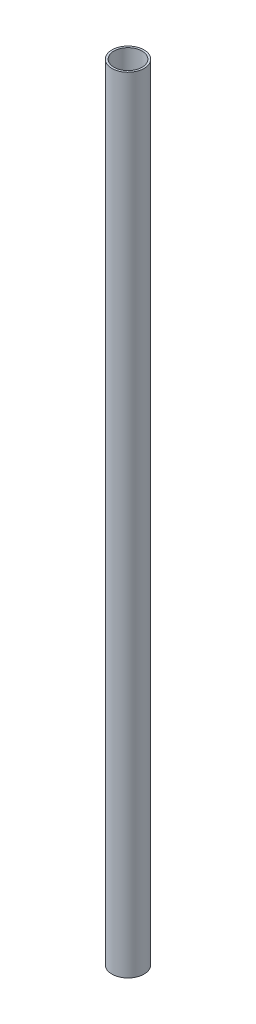
from build123d import *

# Parameters (mm, degrees)
SKETCH1_R           = 4
SKETCH1_R_2         = 3.5
BOSS_EXTRUDE1_DEPTH = 195


with BuildPart() as part:
    # Sketch1 → Boss-Extrude1 (new body)
    with BuildSketch(Plane(origin=(0, 0, 0), x_dir=(1, 0, 0), z_dir=(0, 1, 0))):
        with Locations(Location((0, 0, 0), (0, 0, 270))):
            Circle(SKETCH1_R)
        with Locations(Location((0, 0, 0), (0, 0, 270))):
            Circle(SKETCH1_R_2, mode=Mode.SUBTRACT)
    extrude(amount=BOSS_EXTRUDE1_DEPTH)


solid = part.part
